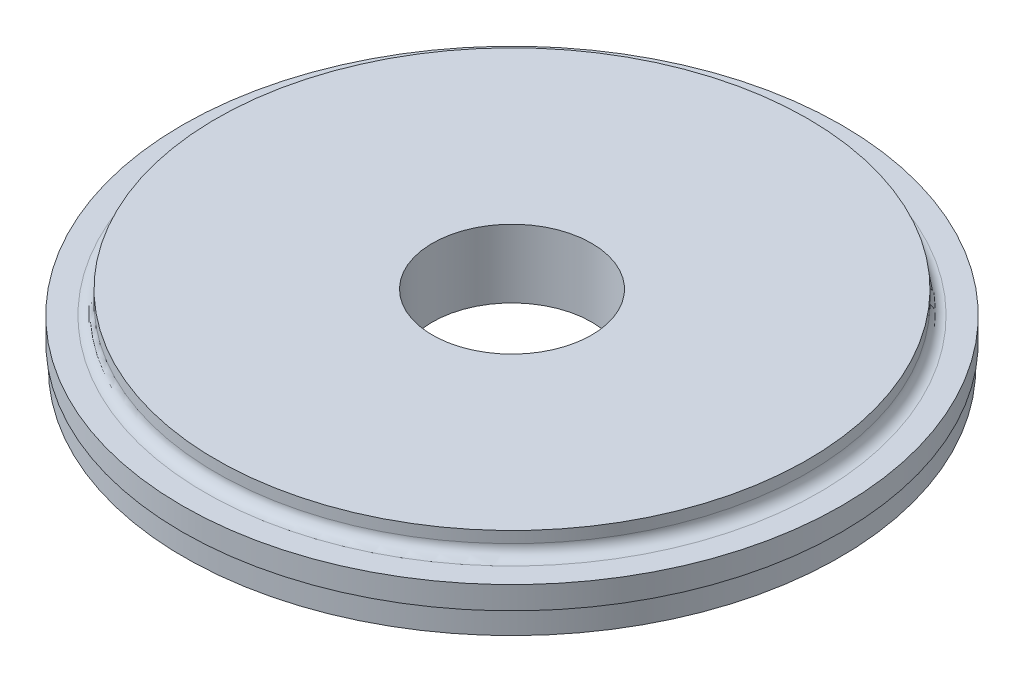
from build123d import *


with BuildPart() as part:
    # 草图1 → 旋转1 (revolve)
    with BuildSketch(Plane(origin=(0, 0, 0), x_dir=(0, 0, -1), z_dir=(1, 0, 0)), mode=Mode.PRIVATE) as revolve_1_sk:
        with BuildLine():
            Line((-17.5, 15), (-17.5, 0))
            Line((-17.5, 0), (-72.1, 0))
            Line((-72.1, 0), (-72.1, 5))
            Line((-72.1, 5), (-72.5, 5))
            Line((-72.5, 5), (-72.5, 10))
            Line((-72.5, 10), (-67.5, 10))
            ThreePointArc((-67.5, 10), (-65.732233047, 10.732233047), (-65, 12.5))
            Line((-65, 12.5), (-65, 15))
            Line((-65, 15), (-17.5, 15))
        make_face()
    revolve(revolve_1_sk.sketch.rotate(Axis((0, 0, 0), (0, 1, 0)), 180), axis=Axis((0, 0, 0), (0, 1, 0)))


solid = part.part
